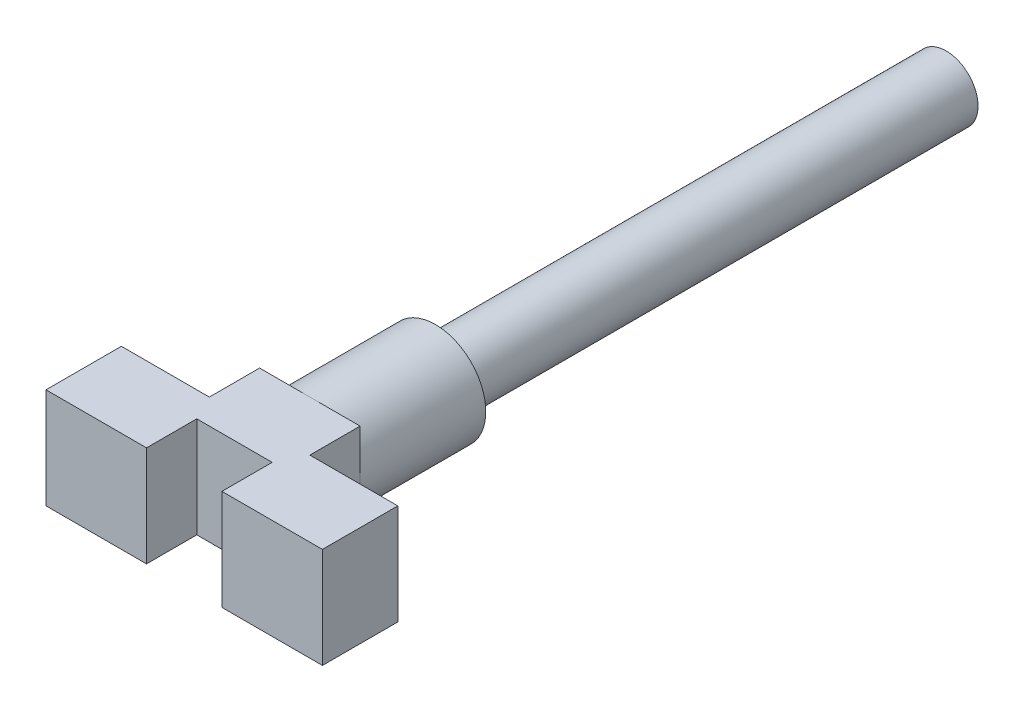
from build123d import *

# Parameters (mm, degrees)
BOSS_EXTRUDE1_DEPTH = 5
SKETCH2_R           = 5
BOSS_EXTRUDE2_DEPTH = 12.5
SKETCH3_R           = 3.175
BOSS_EXTRUDE3_DEPTH = 50.8


with BuildPart() as part:
    # Sketch1 → Boss-Extrude1 (new, symmetric)
    with BuildSketch(Plane(origin=(0, 0, 0), x_dir=(1, 0, 0), z_dir=(0, 1, 0))):
        Polygon((5, 5), (-5, 5), (-5, 0), (-13.75, 0), (-13.75, -7.5), (-3.75, -7.5), (-3.75, -2.5), (3.75, -2.5), (3.75, -7.5), (13.75, -7.5), (13.75, 0), (5, 0), align=None)
    extrude(amount=BOSS_EXTRUDE1_DEPTH, both=True)

    # Sketch2 → Boss-Extrude2 (add)
    with BuildSketch(Plane(origin=(0, 0, -5), x_dir=(-1, 0, 0), z_dir=(0, 0, -1))):
        Circle(SKETCH2_R)
    extrude(amount=BOSS_EXTRUDE2_DEPTH)

    # Sketch3 → Boss-Extrude3 (add)
    with BuildSketch(Plane(origin=(0, 0, -17.5), x_dir=(-1, 0, 0), z_dir=(0, 0, -1))):
        Circle(SKETCH3_R)
    extrude(amount=BOSS_EXTRUDE3_DEPTH)


solid = part.part
